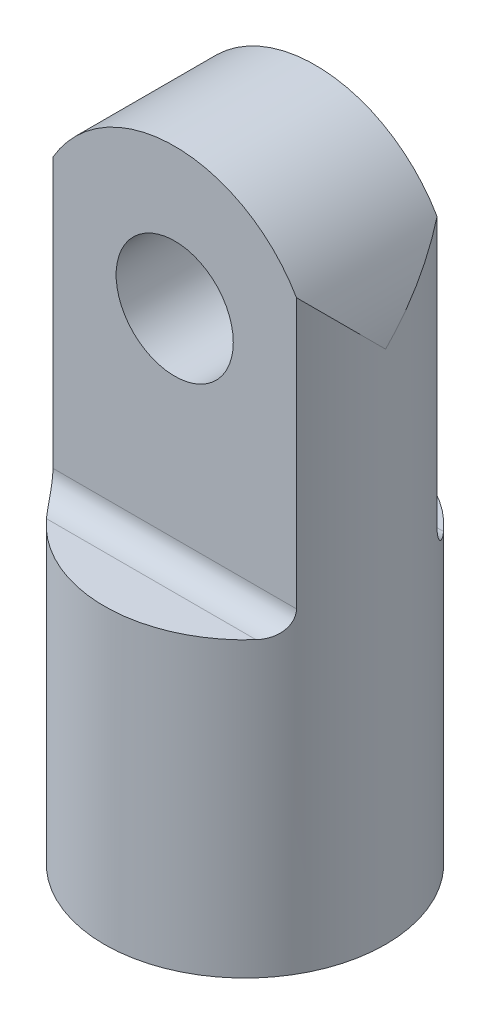
from build123d import *

# Parameters (mm, degrees)
SKETCH1_R           = 6
BOSS_EXTRUDE1_DEPTH = 28
CUT_EXTRUDE1_START  = -15.5
CUT_EXTRUDE1_DEPTH  = 15.5
CUT_EXTRUDE2_DEPTH  = 31.01666204
SKETCH4_R           = 2.5
CUT_EXTRUDE3_DEPTH  = 31.01666204
FILLET1_R           = 1
CUT_EXTRUDE4_DEPTH  = 31.016662183
SKETCH7_R           = 2.5
CUT_EXTRUDE5_DEPTH  = 10


with BuildPart() as part:
    # Sketch1 → Boss-Extrude1 (new body)
    with BuildSketch(Plane(origin=(0, 0, 0), x_dir=(1, 0, 0), z_dir=(0, 1, 0))):
        with Locations(Location((0, 0, 0), (0, 0, 270))):
            Circle(SKETCH1_R)
    extrude(amount=BOSS_EXTRUDE1_DEPTH)

    # Sketch2 → Cut-Extrude1 (cut)
    with BuildSketch(Plane(origin=(0, 28, 0), x_dir=(1, 0, 0), z_dir=(0, 1, 0)).offset(CUT_EXTRUDE1_START)):
        with BuildLine():
            ThreePointArc((5.196152423, 3), (0, 6), (-5.196152423, 3))
            Line((-5.196152423, 3), (5.196152423, 3))
        make_face()
        with BuildLine():
            Line((5.196152423, -3), (-5.196152423, -3))
            ThreePointArc((-5.196152423, -3), (0, -6), (5.196152423, -3))
        make_face()
    extrude(amount=CUT_EXTRUDE1_DEPTH, mode=Mode.SUBTRACT)

    # Sketch3 → Cut-Extrude2 (cut, through all)
    with BuildSketch(Plane.XY.offset(3)):
        with BuildLine():
            ThreePointArc((-5.196152423, 25), (-3, 27.196152423), (0, 28))
            Line((0, 28), (-5.196152423, 28))
            Line((-5.196152423, 28), (-5.196152423, 25))
        make_face()
        with BuildLine():
            ThreePointArc((0, 28), (3, 27.196152423), (5.196152423, 25))
            Line((5.196152423, 25), (5.196152423, 28))
            Line((5.196152423, 28), (0, 28))
        make_face()
    extrude(amount=-CUT_EXTRUDE2_DEPTH, mode=Mode.SUBTRACT)

    # Sketch4 → Cut-Extrude3 (cut, through all)
    with BuildSketch(Plane.XY.offset(3)):
        with Locations((0, 22)):
            Circle(SKETCH4_R)
    extrude(amount=-CUT_EXTRUDE3_DEPTH, mode=Mode.SUBTRACT)

    # Fillet1
    fillet1_edges = [part.edges().sort_by_distance(p)[0] for p in [
        (0, 12.5, -3),
        (0, 12.5, 3),
    ]]
    fillet(fillet1_edges, radius=FILLET1_R)

    # Sketch6 → Cut-Extrude4 (cut, through all)
    with BuildSketch(Plane.XY.offset(3)):
        with BuildLine():
            Line((-6, 28), (-6, 22))
            ThreePointArc((-6, 22), (-5.795554958, 23.552914271), (-5.196152423, 25))
            ThreePointArc((-5.196152423, 25), (-3, 27.196152423), (0, 28))
            Line((0, 28), (-6, 28))
        make_face()
        with BuildLine():
            ThreePointArc((5.196152423, 25), (5.795554958, 23.552914271), (6, 22))
            Line((6, 22), (6, 28))
            Line((6, 28), (0, 28))
            ThreePointArc((0, 28), (3, 27.196152423), (5.196152423, 25))
        make_face()
    extrude(amount=-CUT_EXTRUDE4_DEPTH, mode=Mode.SUBTRACT)

    # Sketch7 → Cut-Extrude5 (cut)
    with BuildSketch(Plane.XZ):
        with Locations(Location((0, 0, 0), (0, 0, 270))):
            Circle(SKETCH7_R)
    extrude(amount=-CUT_EXTRUDE5_DEPTH, mode=Mode.SUBTRACT)


solid = part.part
